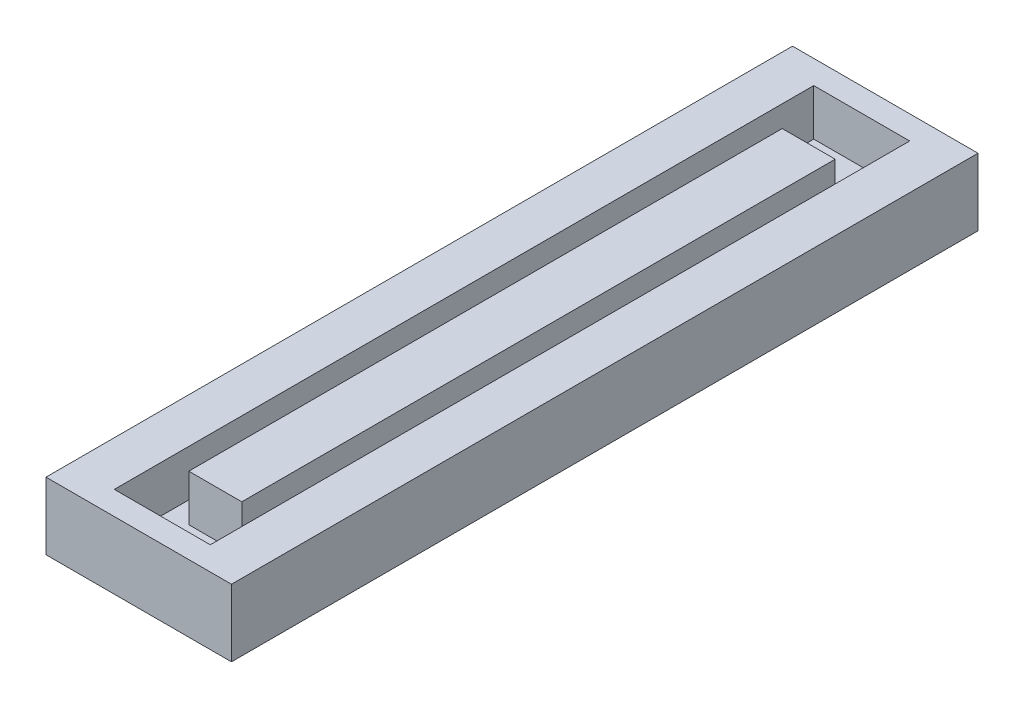
from build123d import *

# Parameters (mm, degrees)
SKETCH1_W           = 4
SKETCH1_H           = 16.1
BOSS_EXTRUDE1_DEPTH = 1.45
SKETCH2_W           = 2.0696
SKETCH2_H           = 15.084
CUT_EXTRUDE1_DEPTH  = 1
SKETCH3_W           = 1.143
SKETCH3_H           = 12.798
BOSS_EXTRUDE2_DEPTH = 1


with BuildPart() as part:
    # Sketch1 → Boss-Extrude1 (new body)
    with BuildSketch(Plane(origin=(0, 1.45, 0), x_dir=(-1, 0, 0), z_dir=(0, 1, 0))):
        Rectangle(SKETCH1_W, SKETCH1_H)
    extrude(amount=-BOSS_EXTRUDE1_DEPTH)

    # Sketch2 → Cut-Extrude1 (cut)
    with BuildSketch(Plane(origin=(0, 1.45, 0), x_dir=(-1, 0, 0), z_dir=(0, 1, 0))):
        Rectangle(SKETCH2_W, SKETCH2_H)
    extrude(amount=-CUT_EXTRUDE1_DEPTH, mode=Mode.SUBTRACT)

    # Sketch3 → Boss-Extrude2 (add)
    with BuildSketch(Plane(origin=(0, 0.45, 0), x_dir=(-1, 0, 0), z_dir=(0, 1, 0))):
        Rectangle(SKETCH3_W, SKETCH3_H)
    extrude(amount=BOSS_EXTRUDE2_DEPTH)


solid = part.part
